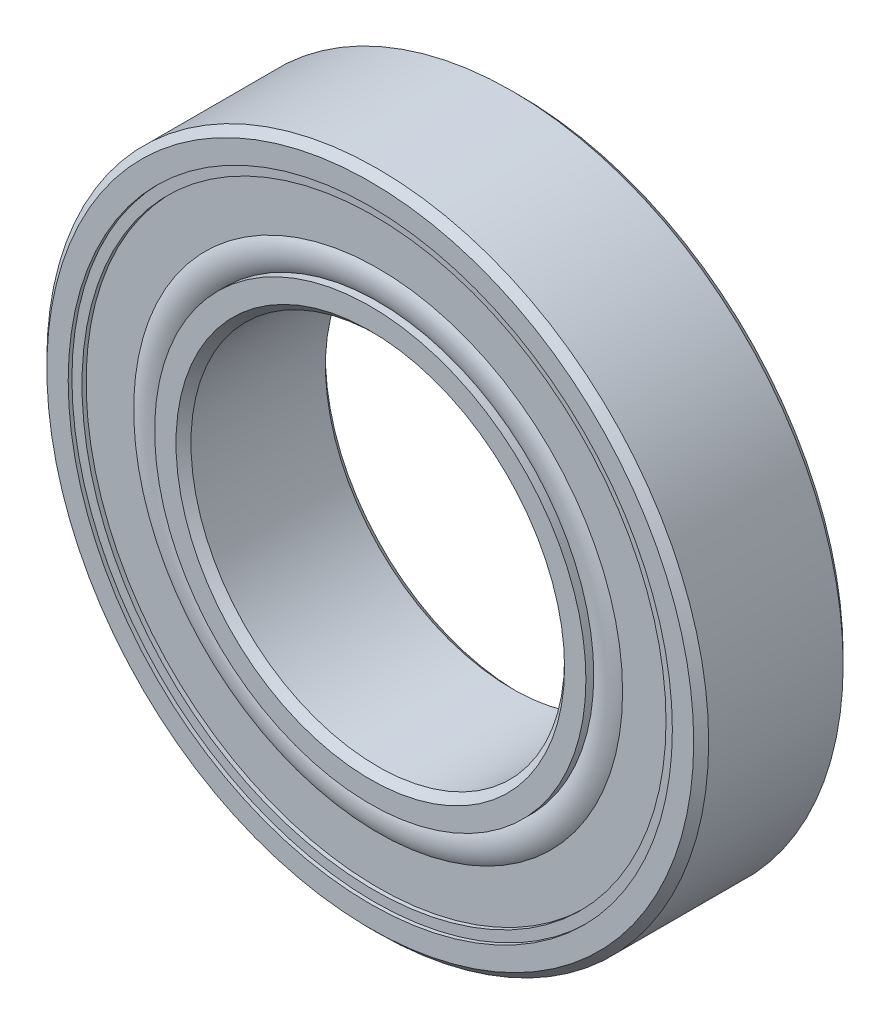
from build123d import *

# Parameters (mm, degrees)
CIRPATTERN1_COUNT = 10


with BuildPart() as part:
    # Sketch3 → Revolve1 (revolve)
    with BuildSketch(Plane(origin=(0, 0, 0), x_dir=(0, 0, -1), z_dir=(1, 0, 0)), mode=Mode.PRIVATE) as revolve1_sk:
        with BuildLine():
            Line((-7, 30.3), (-7, 28.3))
            Line((-7, 28.3), (-3.111111111, 28.3))
            ThreePointArc((-3.111111111, 28.3), (0, 29.357006202), (3.111111111, 28.3))
            Line((3.111111111, 28.3), (7, 28.3))
            Line((7, 28.3), (7, 30.3))
            Line((7, 30.3), (6.3, 31))
            Line((6.3, 31), (-6.3, 31))
            Line((-6.3, 31), (-7, 30.3))
        make_face()
        with BuildLine():
            Line((-7, 18.2), (-7, 20.2))
            Line((-7, 20.2), (-3.111111111, 20.2))
            ThreePointArc((-3.111111111, 20.2), (0, 19.142993798), (3.111111111, 20.2))
            Line((3.111111111, 20.2), (7, 20.2))
            Line((7, 20.2), (7, 18.2))
            Line((7, 18.2), (6.3, 17.5))
            Line((6.3, 17.5), (-6.3, 17.5))
            Line((-6.3, 17.5), (-7, 18.2))
        make_face()
    revolve(revolve1_sk.sketch.rotate(Axis((0, 0, 7), (0, 0, -1)), 90), axis=Axis((0, 0, 7), (0, 0, -1)))


with BuildPart() as body_2:
    # Sketch4 → Revolve2 (revolve)
    with BuildSketch(Plane(origin=(0, 0, 0), x_dir=(0, 0, -1), z_dir=(1, 0, 0))):
        with BuildLine():
            Line((-5.107006202, 24.25), (5.107006202, 24.25))
            ThreePointArc((5.107006202, 24.25), (0, 29.357006202), (-5.107006202, 24.25))
        make_face()
    revolve(axis=Axis((0, 24.25, 5.107006202), (0, 0, -1)))


with BuildPart() as cirpattern1_1:
    # CirPattern1: pattern copy
    add(body_2.part.rotate(Axis((0, 0, 0), (0, 0, 1)), 1 * 360 / CIRPATTERN1_COUNT))


with BuildPart() as cirpattern1_2:
    # CirPattern1: pattern copy
    add(body_2.part.rotate(Axis((0, 0, 0), (0, 0, 1)), 2 * 360 / CIRPATTERN1_COUNT))


with BuildPart() as cirpattern1_3:
    # CirPattern1: pattern copy
    add(body_2.part.rotate(Axis((0, 0, 0), (0, 0, 1)), 3 * 360 / CIRPATTERN1_COUNT))


with BuildPart() as cirpattern1_4:
    # CirPattern1: pattern copy
    add(body_2.part.rotate(Axis((0, 0, 0), (0, 0, 1)), 4 * 360 / CIRPATTERN1_COUNT))


with BuildPart() as cirpattern1_5:
    # CirPattern1: pattern copy
    add(body_2.part.rotate(Axis((0, 0, 0), (0, 0, 1)), 5 * 360 / CIRPATTERN1_COUNT))


with BuildPart() as cirpattern1_6:
    # CirPattern1: pattern copy
    add(body_2.part.rotate(Axis((0, 0, 0), (0, 0, 1)), 6 * 360 / CIRPATTERN1_COUNT))


with BuildPart() as cirpattern1_7:
    # CirPattern1: pattern copy
    add(body_2.part.rotate(Axis((0, 0, 0), (0, 0, 1)), 7 * 360 / CIRPATTERN1_COUNT))


with BuildPart() as cirpattern1_8:
    # CirPattern1: pattern copy
    add(body_2.part.rotate(Axis((0, 0, 0), (0, 0, 1)), 8 * 360 / CIRPATTERN1_COUNT))


with BuildPart() as cirpattern1_9:
    # CirPattern1: pattern copy
    add(body_2.part.rotate(Axis((0, 0, 0), (0, 0, 1)), 9 * 360 / CIRPATTERN1_COUNT))


with BuildPart() as body_12:
    # Sketch5 → Revolve3 (revolve)
    with BuildSketch(Plane(origin=(0, 0, 0), x_dir=(0, 0, -1), z_dir=(1, 0, 0)), mode=Mode.PRIVATE) as revolve3_sk:
        with BuildLine():
            Line((-6.65, 28.3), (-5.107006202, 28.3))
            Line((-5.107006202, 28.3), (-5.107006202, 20.2))
            Line((-5.107006202, 20.2), (-6.26425155, 20.2))
            ThreePointArc((-6.26425155, 20.2), (-6.65, 21.55), (-6.26425155, 22.9))
            Line((-6.26425155, 22.9), (-6.26425155, 27.355))
            Line((-6.26425155, 27.355), (-6.65, 27.355))
            Line((-6.65, 27.355), (-6.65, 28.3))
        make_face()
        with BuildLine():
            Line((6.26425155, 20.2), (5.107006202, 20.2))
            Line((5.107006202, 20.2), (5.107006202, 28.3))
            Line((5.107006202, 28.3), (6.65, 28.3))
            Line((6.65, 28.3), (6.65, 27.355))
            Line((6.65, 27.355), (6.26425155, 27.355))
            Line((6.26425155, 27.355), (6.26425155, 22.9))
            ThreePointArc((6.26425155, 22.9), (6.65, 21.55), (6.26425155, 20.2))
        make_face()
    revolve(revolve3_sk.sketch.rotate(Axis((0, 0, 7), (0, 0, -1)), 90), axis=Axis((0, 0, 7), (0, 0, -1)))


solid = Compound([part.part, body_2.part, cirpattern1_1.part, cirpattern1_2.part, cirpattern1_3.part, cirpattern1_4.part, cirpattern1_5.part, cirpattern1_6.part, cirpattern1_7.part, cirpattern1_8.part, cirpattern1_9.part, body_12.part])
